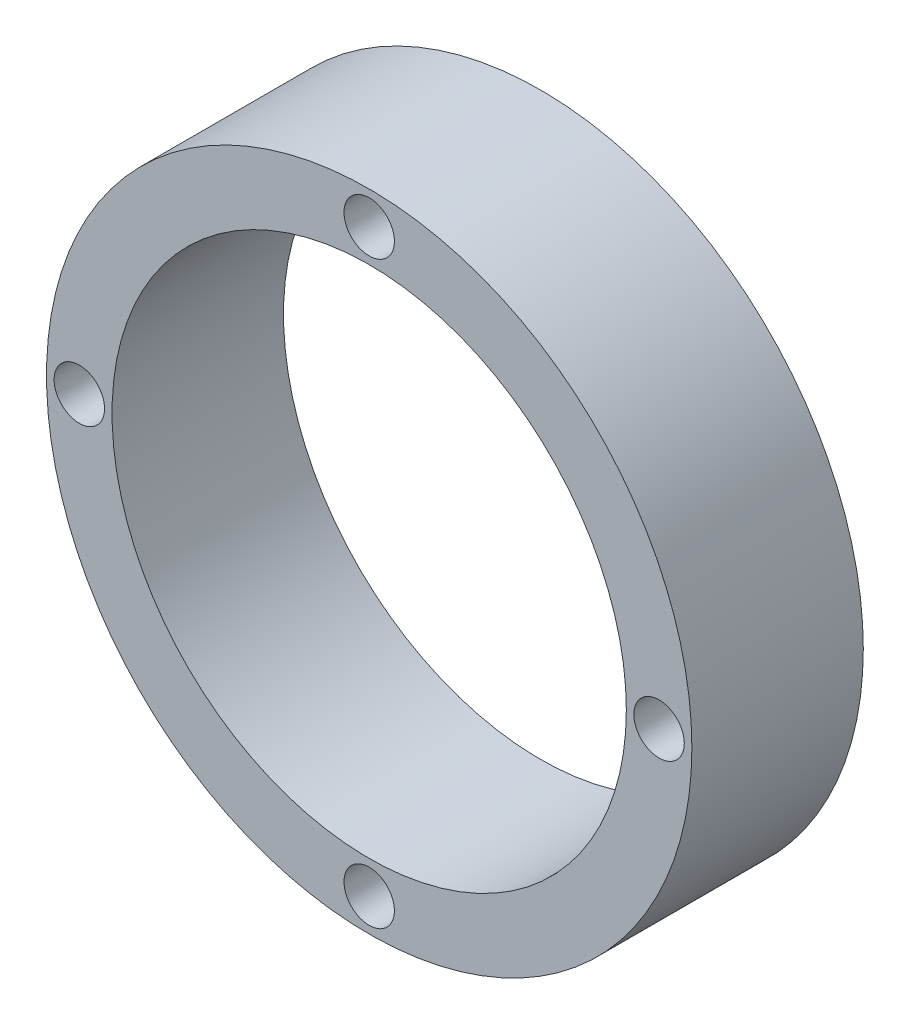
from build123d import *

# Parameters (mm, degrees)
SKETCH1_R           = 32
SKETCH1_R_2         = 25.5
SKETCH1_R_3         = 2.5
BOSS_EXTRUDE1_DEPTH = 17


with BuildPart() as part:
    # Sketch1 → Boss-Extrude1 (new body)
    with BuildSketch(Plane.XY):
        Circle(SKETCH1_R)
        Circle(SKETCH1_R_2, mode=Mode.SUBTRACT)
        with Locations((0, 28.745413537)):
            Circle(SKETCH1_R_3, mode=Mode.SUBTRACT)
        with Locations((28.745413537, 0)):
            Circle(SKETCH1_R_3, mode=Mode.SUBTRACT)
        with Locations((0, -28.745413537)):
            Circle(SKETCH1_R_3, mode=Mode.SUBTRACT)
        with Locations((-28.745413537, 0)):
            Circle(SKETCH1_R_3, mode=Mode.SUBTRACT)
    extrude(amount=BOSS_EXTRUDE1_DEPTH)


solid = part.part
